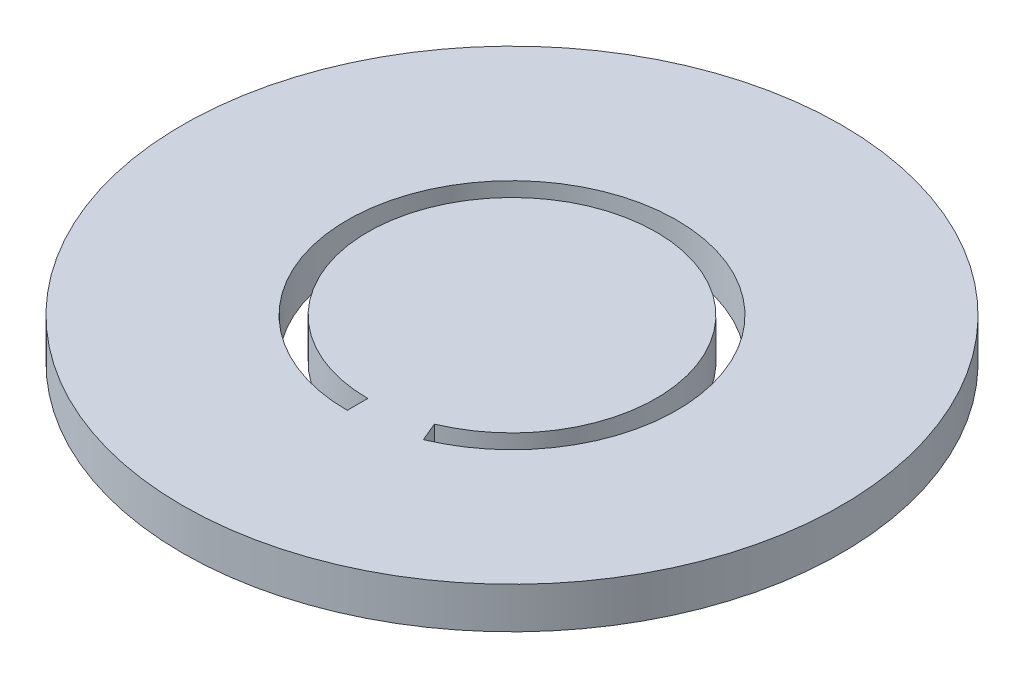
from build123d import *

# Parameters (mm, degrees)
SKETCH1_R           = 4
BOSS_EXTRUDE1_DEPTH = 0.5


with BuildPart() as part:
    # Sketch1 → Boss-Extrude1 (new body)
    with BuildSketch(Plane(origin=(0, 0, 0), x_dir=(1, 0, 0), z_dir=(0, 1, 0))):
        with Locations(Location((0, 0, 0), (0, 0, 270))):
            Circle(SKETCH1_R)
        with BuildLine():
            Line((0.67335903, -1.615267042), (0.769553177, -1.846019477))
            ThreePointArc((0.769553177, -1.846019477), (-0.392403521, 1.961127093), (0, -2))
            Line((0, -2), (0, -1.75))
            ThreePointArc((0, -1.75), (-0.343353081, 1.715986207), (0.67335903, -1.615267042))
        make_face(mode=Mode.SUBTRACT)
    extrude(amount=BOSS_EXTRUDE1_DEPTH)


solid = part.part
